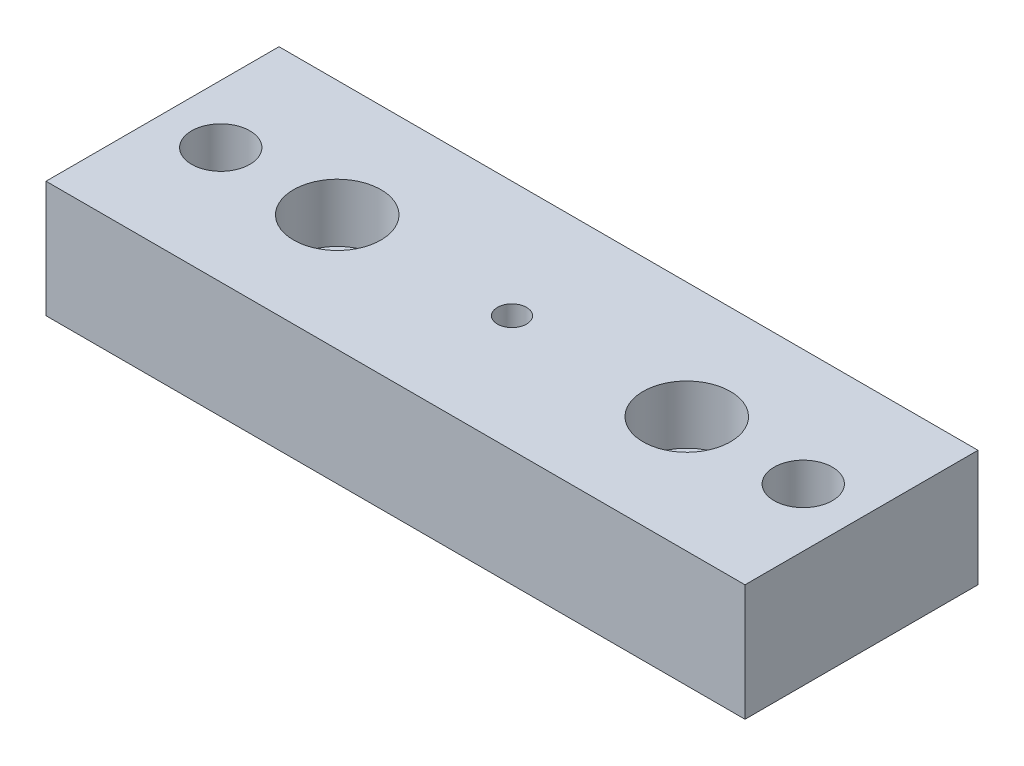
from build123d import *

# Parameters (mm, degrees)
CROQUIS1_W     = 120
CROQUIS1_H     = 40
EXTRUIR1_DEPTH = 20
CROQUIS2_R     = 5
EXTRUIR2_DEPTH = 67.332495807
CROQUIS4_R     = 7.5
CROQUIS4_R_2   = 2.5
EXTRUIR3_DEPTH = 10


with BuildPart() as part:
    # Croquis1 → Extruir1 (new body)
    with BuildSketch(Plane(origin=(0, 0, 0), x_dir=(1, 0, 0), z_dir=(0, 1, 0))):
        Rectangle(CROQUIS1_W, CROQUIS1_H)
    extrude(amount=EXTRUIR1_DEPTH)

    # Croquis2 → Extruir2 (cut, through all)
    with BuildSketch(Plane(origin=(0, 20, 0), x_dir=(1, 0, 0), z_dir=(0, 1, 0))):
        with Locations(Location((-50, 0, 0), (0, 0, 270))):
            Circle(CROQUIS2_R)
        with Locations(Location((50, 0, 0), (0, 0, 90))):
            Circle(CROQUIS2_R)
    extrude(amount=-EXTRUIR2_DEPTH, mode=Mode.SUBTRACT)

    # Croquis4 → Extruir3 (cut)
    with BuildSketch(Plane(origin=(0, 20, 0), x_dir=(1, 0, 0), z_dir=(0, 1, 0))):
        with Locations(Location((-30, 0, 0), (0, 0, 270))):
            Circle(CROQUIS4_R)
        with Locations(Location((30, 0, 0), (0, 0, 90))):
            Circle(CROQUIS4_R)
        with Locations(Location((0, 0, 0), (0, 0, 270))):
            Circle(CROQUIS4_R_2)
    extrude(amount=-EXTRUIR3_DEPTH, mode=Mode.SUBTRACT)


solid = part.part
